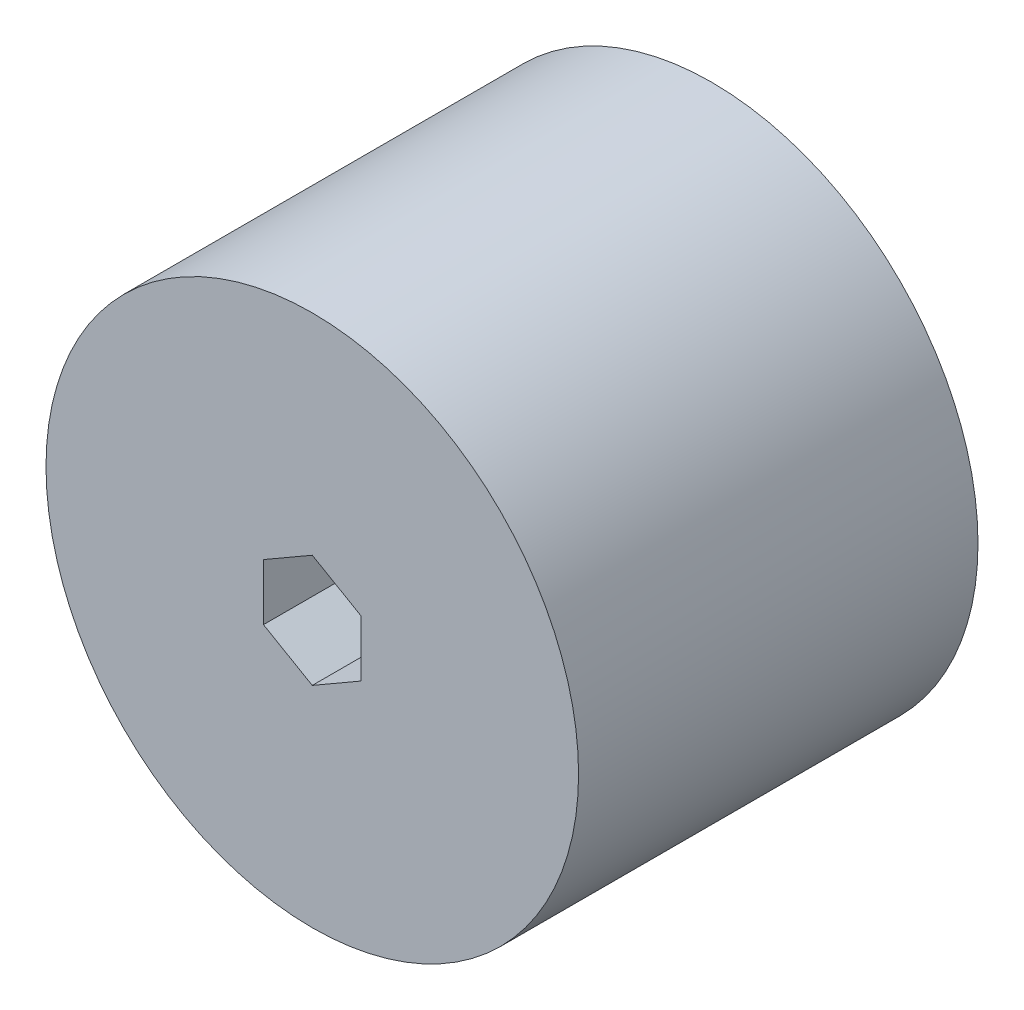
from build123d import *

# Parameters (mm, degrees)
SKETCH1_R           = 38.1
BOSS_EXTRUDE1_DEPTH = 57.15


with BuildPart() as part:
    # Sketch1 → Boss-Extrude1 (new body)
    with BuildSketch(Plane.XY):
        Circle(SKETCH1_R)
        Polygon((0, 8.065583261), (-6.985, 4.03279163), (-6.985, -4.03279163), (0, -8.065583261), (6.985, -4.03279163), (6.985, 4.03279163), align=None, mode=Mode.SUBTRACT)
    extrude(amount=BOSS_EXTRUDE1_DEPTH)


solid = part.part
